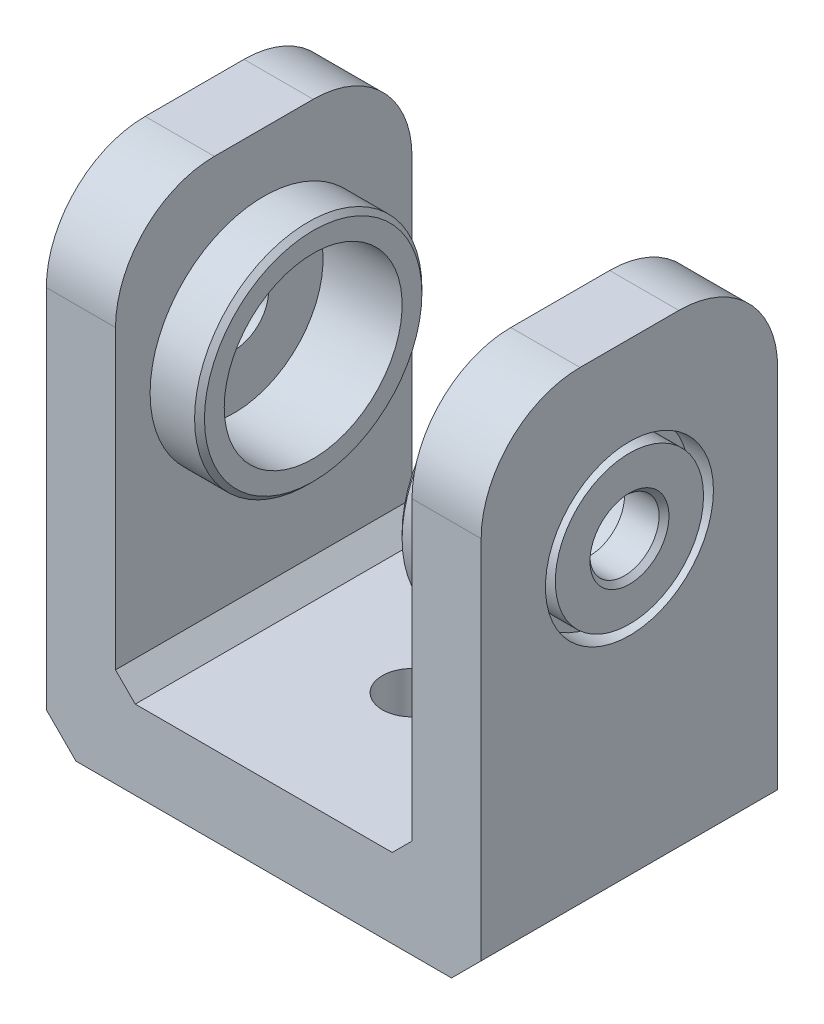
from build123d import *

# Parameters (mm, degrees)
SKETCH_1_R          = 10
EXTRUDE_1_DEPTH     = 13
CUT_EXTRUDE_2_DEPTH = 20.209373
SKETCH_7_W          = 30
SKETCH_7_H          = 30
SKETCH_7_R          = 10
EXTRUDE_2_DEPTH     = 8
SKETCH_11_W         = 7
SKETCH_11_H         = 30
EXTRUDE_6_DEPTH     = 50
FILLET_2_R          = 10
SKETCH_13_R         = 8.5
SKETCH_13_R_2       = 7.5
CUT_EXTRUDE_3_DEPTH = 2.5
SKETCH_14_R         = 3.5
CUT_EXTRUDE_4_DEPTH = 37
SKETCH_22_W         = 20
SKETCH_22_H         = 6
EXTRUDE_8_DEPTH     = 18.5
CHAMFER_7_SIZE      = 2
SKETCH_23_R         = 9
CUT_EXTRUDE_6_DEPTH = 3
CHAMFER_8_SIZE      = 2
CUT_EXTRUDE_START   = -5
SKETCH_24_R         = 10
CUT_EXTRUDE_7_DEPTH = 5
CUT_EXTRUDE_START_2 = -2
SKETCH_25_R         = 3
CUT_EXTRUDE_8_DEPTH = 2
CHAMFER_9_SIZE      = 3
CHAMFER_10_SIZE     = 1
CHAMFER_3_SIZE      = 2
EXTRUDE_START       = 5
SKETCH_26_R         = 11.5
SKETCH_26_R_2       = 9
EXTRUDE_9_DEPTH     = 5
CHAMFER_4_SIZE      = 0.5


with BuildPart() as part:
    # 草图1 → 凸台-拉伸1 (new body)
    with BuildSketch(Plane(origin=(0, 0, 0), x_dir=(1, 0, 0), z_dir=(0, 1, 0))):
        with Locations(Location((0, 0, 0), (0, 0, 90))):
            Circle(SKETCH_1_R)
    extrude(amount=EXTRUDE_1_DEPTH)

    # 草图4 → 切除-拉伸2 (cut, through all)
    with BuildSketch(Plane(origin=(0, 13, 0), x_dir=(1, 0, 0), z_dir=(0, 1, 0))):
        with BuildLine():
            Line((3, 0), (-1.5, 2.598076))
            ThreePointArc((-1.5, 2.598076), (-1.5, -2.598076), (3, 0))
        make_face()
    extrude(amount=-CUT_EXTRUDE_2_DEPTH, mode=Mode.SUBTRACT)

    # 草图7 → 凸台-拉伸2 (add)
    with BuildSketch(Plane.XZ):
        Rectangle(SKETCH_7_W, SKETCH_7_H)
        with Locations(Location((0, 0, 0), (0, 0, 270))):
            Circle(SKETCH_7_R, mode=Mode.SUBTRACT)
    extrude(amount=-EXTRUDE_2_DEPTH)

    # 草图11 → 凸台-拉伸6 (add)
    with BuildSketch(Plane.XZ):
        with Locations((-18.5, 0)):
            Rectangle(SKETCH_11_W, SKETCH_11_H)
        with Locations((18.5, 0)):
            Rectangle(SKETCH_11_W, SKETCH_11_H)
    extrude(amount=-EXTRUDE_6_DEPTH)

    # 圆角2
    fillet_2_edges = [part.edges().sort_by_distance(p)[0] for p in [
        (-18.5, 50, -15),
        (-18.5, 50, 15),
        (18.5, 50, 15),
        (18.5, 50, -15),
    ]]
    fillet(fillet_2_edges, radius=FILLET_2_R)

    # 草图13 → 切除-拉伸3 (cut)
    with BuildSketch(Plane(origin=(22, 0, 0), x_dir=(0, 0, -1), z_dir=(1, 0, 0))):
        with Locations((0, 32.5)):
            Circle(SKETCH_13_R)
        with Locations((0, 32.5)):
            Circle(SKETCH_13_R_2, mode=Mode.SUBTRACT)
    cut_extrude_3 = extrude(amount=-CUT_EXTRUDE_3_DEPTH, mode=Mode.SUBTRACT)

    # 草图14 → 切除-拉伸4 (cut)
    with BuildSketch(Plane(origin=(22, 0, 0), x_dir=(0, 0, -1), z_dir=(1, 0, 0))):
        with Locations((0, 32.5)):
            Circle(SKETCH_14_R)
    cut_extrude_4 = extrude(amount=-CUT_EXTRUDE_4_DEPTH, mode=Mode.SUBTRACT)

    # 草图22 → 凸台-拉伸8 (add)
    with BuildSketch(Plane.XZ):
        with Locations((0, -18)):
            Rectangle(SKETCH_22_W, SKETCH_22_H)
    extrude(amount=-EXTRUDE_8_DEPTH)

    # 倒角7
    chamfer_7_edges = [part.edges().sort_by_distance(p)[0] for p in [
        (10, 4, -15),
        (-10, 4, -15),
    ]]
    chamfer(chamfer_7_edges, length=CHAMFER_7_SIZE)

    # 草图23 → 切除-拉伸6 (cut)
    with BuildSketch(Plane.ZY.offset(-15)):
        with Locations((0, 32.5)):
            Circle(SKETCH_23_R)
    cut_extrude_6 = extrude(amount=-CUT_EXTRUDE_6_DEPTH, mode=Mode.SUBTRACT)

    # 倒角8
    chamfer_8_edges = [part.edges().sort_by_distance(p)[0] for p in [
        (10, 18.5, -18),
        (10, 9.25, -21),
        (-10, 18.5, -18),
        (-10, 9.25, -21),
    ]]
    chamfer(chamfer_8_edges, length=CHAMFER_8_SIZE)

    # 草图24 → 切除-拉伸7 (cut)
    with BuildSketch(Plane(origin=(0, 13, 0), x_dir=(1, 0, 0), z_dir=(0, 1, 0)).offset(CUT_EXTRUDE_START)):
        Circle(SKETCH_24_R)
    extrude(amount=CUT_EXTRUDE_7_DEPTH, mode=Mode.SUBTRACT)

    # 草图25 → 切除-拉伸8 (cut)
    with BuildSketch(Plane.XZ.offset(CUT_EXTRUDE_START_2)):
        with Locations(Location((0, 0, 0), (0, 0, 90))):
            Circle(SKETCH_25_R)
    extrude(amount=CUT_EXTRUDE_8_DEPTH, mode=Mode.SUBTRACT)

    # 倒角9
    chamfer_9_edges = [part.edges().sort_by_distance(p)[0] for p in [
        (-22, 0, 0),
        (22, 0, 0),
    ]]
    chamfer(chamfer_9_edges, length=CHAMFER_9_SIZE)

    # 倒角10
    chamfer_10_edges = [part.edges().sort_by_distance(p)[0] for p in [
        (1.5, 0, 2.598076),
    ]]
    chamfer(chamfer_10_edges, length=CHAMFER_10_SIZE)

    # 倒角3
    chamfer_3_edges = [part.edges().sort_by_distance(p)[0] for p in [
        (15, 8, 0),
        (-15, 8, 0),
        (0, 8, -15),
    ]]
    chamfer(chamfer_3_edges, length=CHAMFER_3_SIZE)

    # 草图26 → 凸台-拉伸9 (add)
    with BuildSketch(Plane.ZY.offset(-15).offset(EXTRUDE_START)):
        with Locations((0, 32.5)):
            Circle(SKETCH_26_R)
        with Locations((0, 32.5)):
            Circle(SKETCH_26_R_2, mode=Mode.SUBTRACT)
    extrude_9 = extrude(amount=-EXTRUDE_9_DEPTH)

    # 镜向2: 切除-拉伸3, 切除-拉伸4, 切除-拉伸6, 凸台-拉伸9 across plane
    add(cut_extrude_3.mirror(Plane(origin=(0, 0, 0), x_dir=(0, 0, 1), z_dir=(1, 0, 0))), mode=Mode.SUBTRACT)
    add(cut_extrude_4.mirror(Plane(origin=(0, 0, 0), x_dir=(0, 0, 1), z_dir=(1, 0, 0))), mode=Mode.SUBTRACT)
    add(cut_extrude_6.mirror(Plane(origin=(0, 0, 0), x_dir=(0, 0, 1), z_dir=(1, 0, 0))), mode=Mode.SUBTRACT)
    add(extrude_9.mirror(Plane(origin=(0, 0, 0), x_dir=(0, 0, 1), z_dir=(1, 0, 0))))

    # 倒角4
    chamfer_4_edges = [part.edges().sort_by_distance(p)[0] for p in [
        (10, 32.5, -11.5),
        (-22, 32.5, 3.5),
        (-10, 32.5, -11.5),
        (22, 32.5, 3.5),
    ]]
    chamfer(chamfer_4_edges, length=CHAMFER_4_SIZE)


solid = part.part
